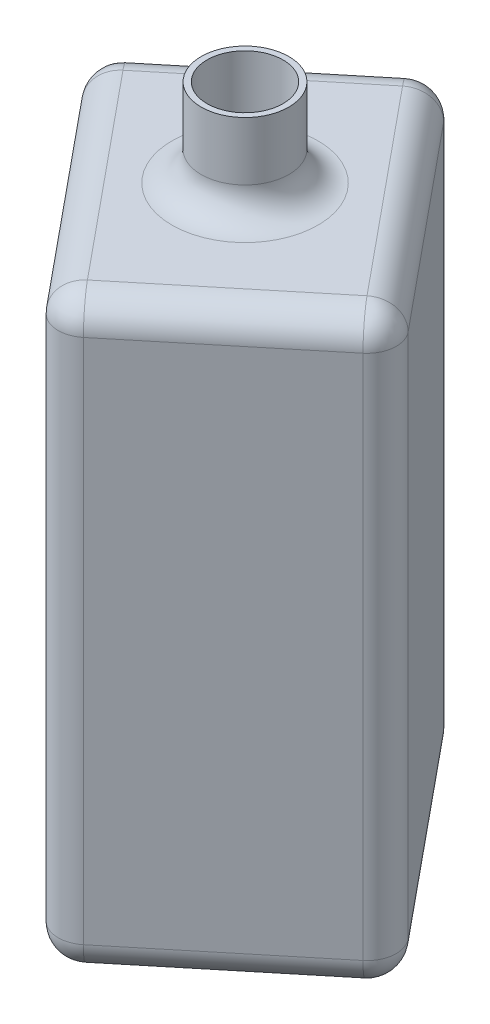
from build123d import *

# Parameters (mm, degrees)
BOSS_EXTRUDE2_DEPTH = 200
BOSS_EXTRUDE3_DEPTH = 200
BOSS_EXTRUDE4_DEPTH = 200
BOSS_EXTRUDE5_REACH = 247.011
SKETCH2_W           = 108.348849956
SKETCH2_H           = 6.424491228
SKETCH2_H_2         = 5.401330914
SKETCH3_R           = 15
SKETCH3_R_2         = 13
BOSS_EXTRUDE6_DEPTH = 30
FILLET4_R           = 10
FILLET5_R           = 10


with BuildPart() as part:
    # Sketch1 → Boss-Extrude2 (new body)
    with BuildSketch(Plane(origin=(0, 0, 0), x_dir=(1, 0, 0), z_dir=(0, 1, 0))):
        Polygon((-0.406350975, 69.787624434), (-68.386407424, 13.920378043), (0.406350975, -69.787624434), (68.386407424, -13.920378043), align=None)
        Polygon((54.311430077, -12.543783452), (-1.782945566, 55.712647086), (-54.311430077, 12.543783452), (1.782945566, -55.712647086), align=None, mode=Mode.SUBTRACT)
    extrude(amount=BOSS_EXTRUDE2_DEPTH)

    # Sketch1<2> → Boss-Extrude3 (add)
    with BuildSketch(Plane(origin=(0, 0, 0), x_dir=(1, 0, 0), z_dir=(0, 1, 0))):
        Polygon((-0.406350975, 69.787624434), (-68.386407424, 13.920378043), (0.406350975, -69.787624434), (68.386407424, -13.920378043), align=None)
        Polygon((54.311430077, -12.543783452), (-1.782945566, 55.712647086), (-54.311430077, 12.543783452), (1.782945566, -55.712647086), align=None, mode=Mode.SUBTRACT)
    extrude(amount=BOSS_EXTRUDE3_DEPTH)

    # Sketch1<4> → Boss-Extrude4 (add)
    with BuildSketch(Plane(origin=(0, 0, 0), x_dir=(1, 0, 0), z_dir=(0, 1, 0))):
        Polygon((-0.406350975, 69.787624434), (-68.386407424, 13.920378043), (0.406350975, -69.787624434), (68.386407424, -13.920378043), align=None)
        Polygon((54.311430077, -12.543783452), (-1.782945566, 55.712647086), (-54.311430077, 12.543783452), (1.782945566, -55.712647086), align=None, mode=Mode.SUBTRACT)
    extrude(amount=BOSS_EXTRUDE4_DEPTH)

    # Sketch2 → Boss-Extrude5 (add, up to next)
    with BuildSketch(Plane(origin=(33.990028225, 0, -27.933623196), x_dir=(-0.6349191378309257, 0, -0.7725785969181609), z_dir=(0.772578596918161, 0, -0.6349191378309257)), mode=Mode.PRIVATE) as boss_extrude5_sk1:
        with Locations((0, 3.212245614)):
            Rectangle(SKETCH2_W, SKETCH2_H)
    boss_extrude5_tool1 = extrude(boss_extrude5_sk1.sketch, amount=-BOSS_EXTRUDE5_REACH, mode=Mode.PRIVATE) - part.part
    # Sketch2 → Boss-Extrude5 (add, up to next)
    with BuildSketch(Plane(origin=(33.990028225, 0, -27.933623196), x_dir=(-0.6349191378309257, 0, -0.7725785969181609), z_dir=(0.772578596918161, 0, -0.6349191378309257)), mode=Mode.PRIVATE) as boss_extrude5_sk2:
        with Locations((0, 197.299334543)):
            Rectangle(SKETCH2_W, SKETCH2_H_2)
    boss_extrude5_tool2 = extrude(boss_extrude5_sk2.sketch, amount=-BOSS_EXTRUDE5_REACH, mode=Mode.PRIVATE) - part.part
    add(boss_extrude5_tool1.solids().sort_by_distance((33.990028, 3.212246, -27.933623))[0])
    add(boss_extrude5_tool2.solids().sort_by_distance((33.990028, 197.299335, -27.933623))[0])

    # Sketch3 → Boss-Extrude6 (add)
    with BuildSketch(Plane(origin=(0, 200, 0), x_dir=(1, 0, 0), z_dir=(0, 1, 0))):
        Circle(SKETCH3_R)
        Circle(SKETCH3_R_2, mode=Mode.SUBTRACT)
    extrude(amount=BOSS_EXTRUDE6_DEPTH)

    # Fillet4
    fillet4_edges = [part.edges().sort_by_distance(p)[0] for p in [
        (-15, 200, 0),
    ]]
    fillet(fillet4_edges, radius=FILLET4_R)

    # Fillet5
    fillet5_edges = [part.edges().sort_by_distance(p)[0] for p in [
        (-33.990028225, 0, 27.933623196),
        (-68.386407424, 100, -13.920378043),
        (-34.396379199, 0, -41.854001238),
        (0.406350975, 100, 69.787624434),
        (34.396379199, 0, 41.854001238),
        (68.386407424, 100, 13.920378043),
        (-0.406350975, 100, -69.787624434),
        (33.990028225, 0, -27.933623196),
        (34.396379199, 200, 41.854001238),
        (-33.990028225, 200, 27.933623196),
        (-34.396379199, 200, -41.854001238),
        (33.990028225, 200, -27.933623196),
    ]]
    fillet(fillet5_edges, radius=FILLET5_R)


solid = part.part
